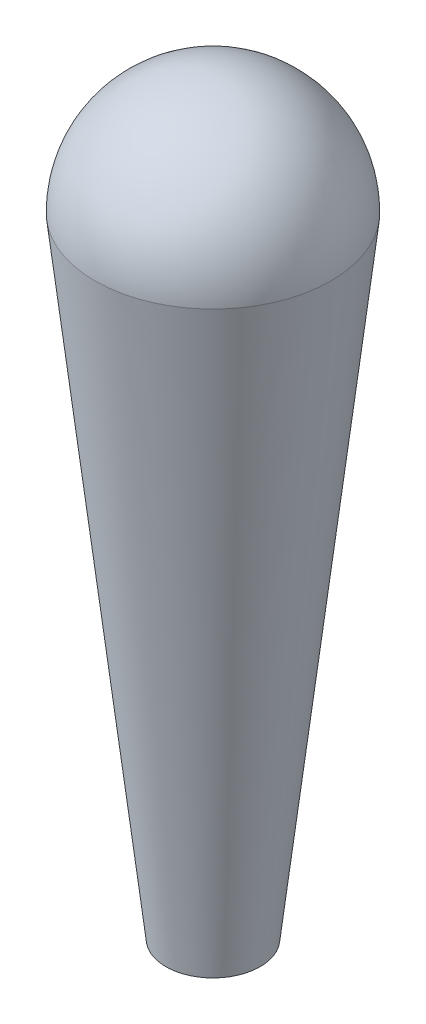
from build123d import *

# Parameters (mm, degrees)
DOME1_FACE_RADIUS = 19.05
DOME1_HEIGHT      = 19.05


with BuildPart() as part:
    # Sketch1 → Revolve1 (revolve)
    with BuildSketch(Plane.XY, mode=Mode.PRIVATE) as revolve1_sk:
        Polygon((0, 0), (0, 101.6), (19.05, 101.6), (7.62, 0), align=None)
    revolve(revolve1_sk.sketch.rotate(Axis((0, 0, 0), (0, 1, 0)), 90), axis=Axis((0, 0, 0), (0, 1, 0)))

    # Dome1: a dome of height H over a round flat face of radius A is a cap of a sphere of radius (A * A + H * H) / (2 * H)
    dome1_r = (DOME1_FACE_RADIUS * DOME1_FACE_RADIUS + DOME1_HEIGHT * DOME1_HEIGHT) / (2 * DOME1_HEIGHT)
    dome1_base = Plane((0, 101.6, 0), z_dir=(0, 1, 0))
    with Locations(dome1_base.offset(DOME1_HEIGHT - dome1_r)):
        dome1_ball = Sphere(dome1_r, mode=Mode.PRIVATE)
    add(split(dome1_ball, bisect_by=dome1_base, keep=Keep.TOP, mode=Mode.PRIVATE))


solid = part.part
